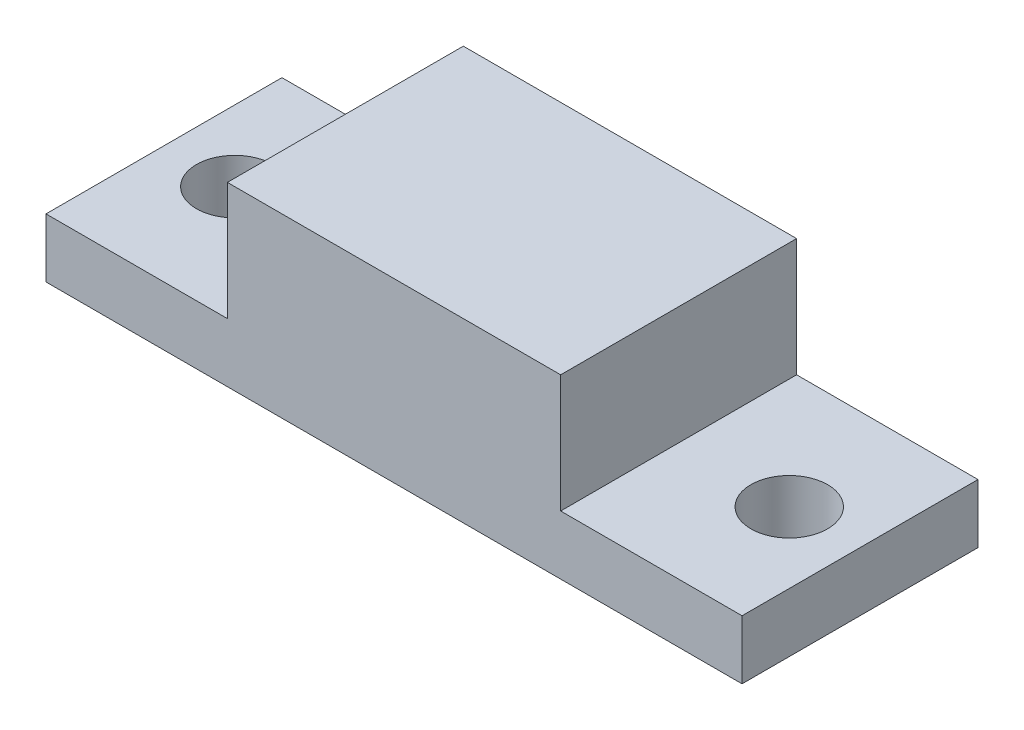
from build123d import *

# Parameters (mm, degrees)
EXTRUDE_1_DEPTH     = 8
CUT_EXTRUDE_1_REACH = 17.467
SKETCH_2_R          = 1.3


with BuildPart() as part:
    # Эскиз1 → Бобышка-Вытянуть1 (new body)
    with BuildSketch(Plane.XY):
        Polygon((-5.65, 0), (5.65, 0), (5.65, -4), (11.8, -4), (11.8, -6), (-11.8, -6), (-11.8, -4), (-5.65, -4), align=None)
    extrude(amount=EXTRUDE_1_DEPTH)

    # Эскиз2 → Вырез-Вытянуть1 (cut, up to next)
    with BuildSketch(Plane.XZ.offset(6), mode=Mode.PRIVATE) as cut_extrude_1_sk1:
        with Locations(Location((-9.4, 4, 0), (0, 0, 270))):
            Circle(SKETCH_2_R)
    cut_extrude_1_tool1 = extrude(cut_extrude_1_sk1.sketch, amount=-CUT_EXTRUDE_1_REACH, mode=Mode.PRIVATE) & part.part
    # Эскиз2 → Вырез-Вытянуть1 (cut, up to next)
    with BuildSketch(Plane.XZ.offset(6), mode=Mode.PRIVATE) as cut_extrude_1_sk2:
        with Locations(Location((9.4, 4, 0), (0, 0, 270))):
            Circle(SKETCH_2_R)
    cut_extrude_1_tool2 = extrude(cut_extrude_1_sk2.sketch, amount=-CUT_EXTRUDE_1_REACH, mode=Mode.PRIVATE) & part.part
    add(cut_extrude_1_tool1.solids().sort_by_distance((-9.4, -6, 4))[0], mode=Mode.SUBTRACT)
    add(cut_extrude_1_tool2.solids().sort_by_distance((9.4, -6, 4))[0], mode=Mode.SUBTRACT)


solid = part.part
